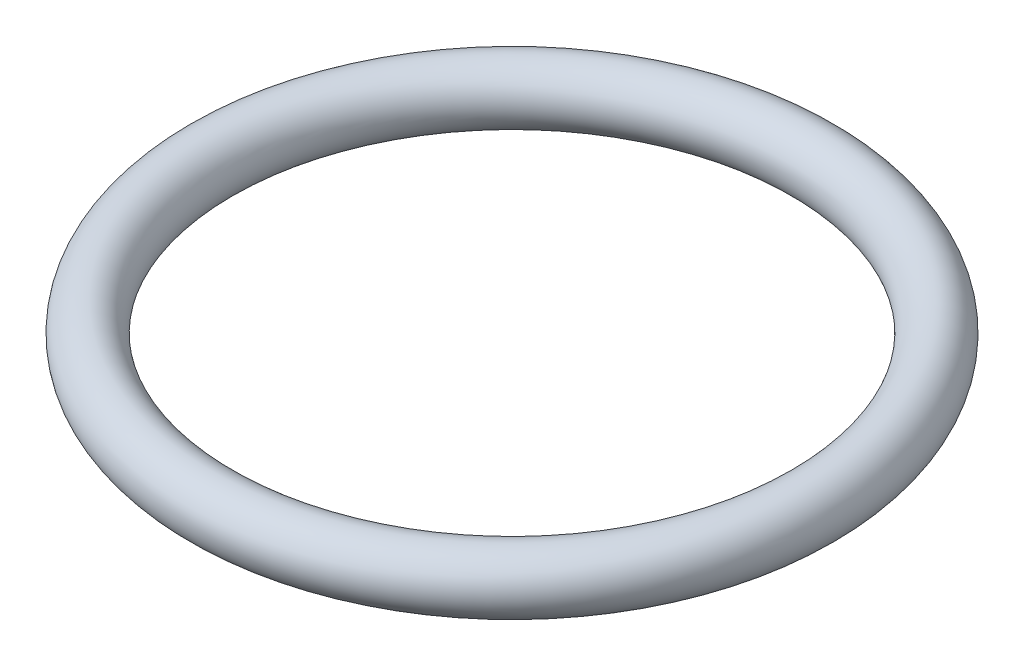
from build123d import *

# Parameters (mm, degrees)
SKETCH_1_R = 2.5


with BuildPart() as part:
    # Эскиз1 → Повернуть1 (revolve)
    with BuildSketch(Plane.XY, mode=Mode.PRIVATE) as revolve_1_sk:
        with Locations((-25.5, 0)):
            Circle(SKETCH_1_R)
    revolve(revolve_1_sk.sketch.rotate(Axis((0, -1000, 0), (0, 1, 0)), 180), axis=Axis((0, -1000, 0), (0, 1, 0)))


solid = part.part
